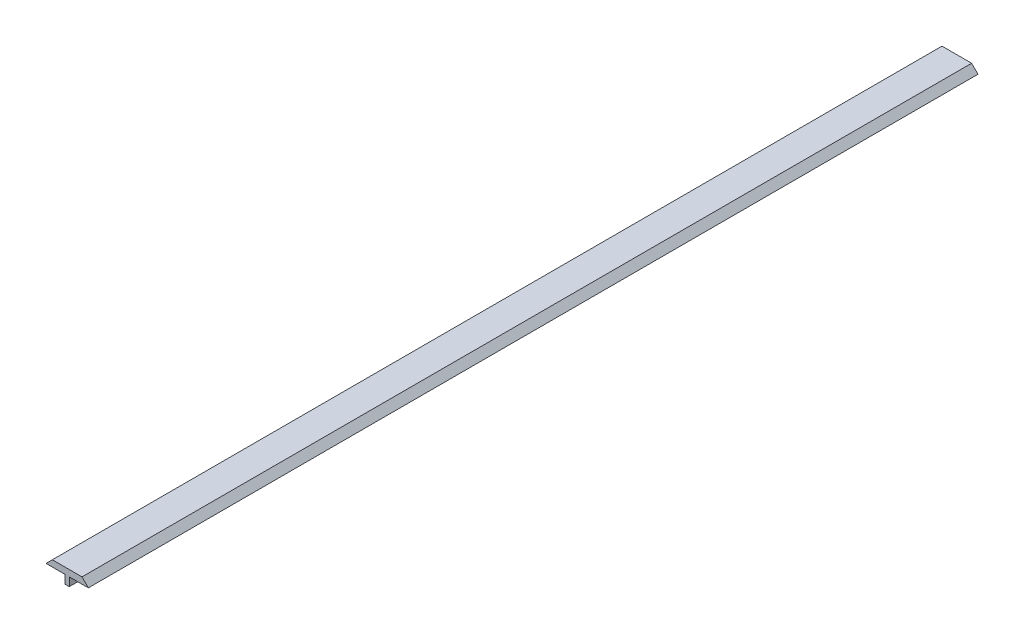
from build123d import *

# Parameters (mm, degrees)
COVER_CONNECTOR_DEPTH = 210


with BuildPart() as part:
    # Sketch1 → cover_connector (new body)
    with BuildSketch(Plane.XY):
        Polygon((0, 0), (1, 0), (1, 2), (5.5, 2), (4, 3.5), (-3, 3.5), (-4.5, 2), (0, 2), align=None)
    extrude(amount=COVER_CONNECTOR_DEPTH)


solid = part.part
